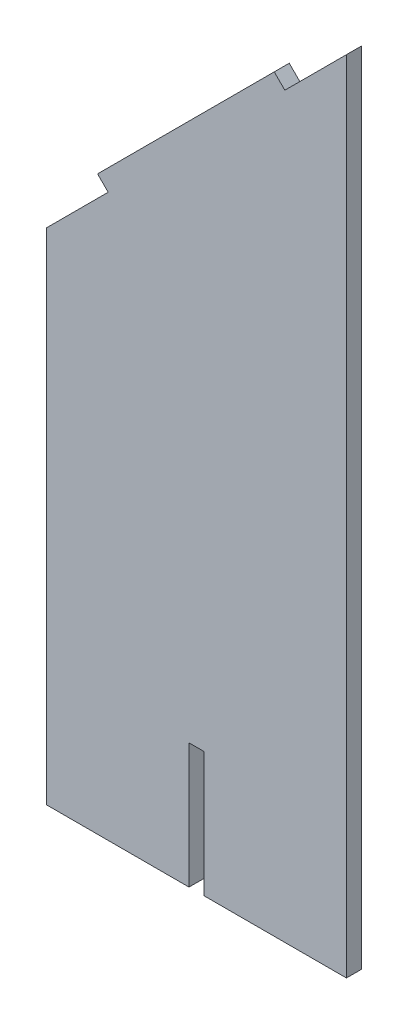
from build123d import *

# Parameters (mm, degrees)
BOSS_EXTRU_1_DEPTH = 3


with BuildPart() as part:
    # Esquisse1 → Boss.-Extru.1 (new body)
    with BuildSketch(Plane.XY):
        Polygon((0, 100), (0, 0), (28.5, 0), (28.5, 25), (31.5, 25), (31.5, 0), (60, 0), (60, 160), (47.676674722, 147.676674722), (45.555354378, 149.797995065), (10.200015319, 114.442656006), (12.321335662, 112.321335662), align=None)
    extrude(amount=BOSS_EXTRU_1_DEPTH)


solid = part.part
